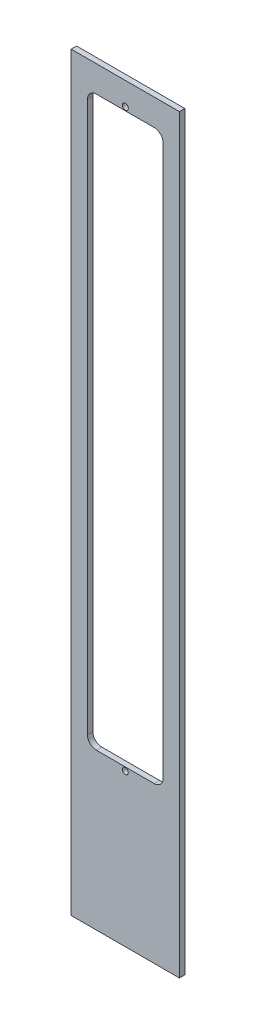
from build123d import *

# Parameters (mm, degrees)
ESQUISSE1_W              = 120
ESQUISSE1_H              = 832
BOSS_EXTRU_1_DEPTH       = 6
CUT_EXTRUDE1_DEPTH       = 10
M6_CLEARANCE_HOLE1_D     = 6.6
M6_CLEARANCE_HOLE1_DEPTH = 6
M6_CLEARANCE_HOLE1_TIP   = 1.982840043


with BuildPart() as part:
    # Esquisse1 → Boss.-Extru.1 (new body)
    with BuildSketch(Plane.XY):
        Rectangle(ESQUISSE1_W, ESQUISSE1_H)
    extrude(amount=BOSS_EXTRU_1_DEPTH)

    # Sketch1 → Cut-Extrude1 (cut)
    with BuildSketch(Plane.XY.offset(6)):
        with BuildLine():
            Line((-42, 376.726304266), (-42, -233.273695734))
            ThreePointArc((-42, -233.273695734), (-39.071067812, -240.344763545), (-32, -243.273695734))
            Line((-32, -243.273695734), (32, -243.273695734))
            ThreePointArc((32, -243.273695734), (39.071067812, -240.344763545), (42, -233.273695734))
            Line((42, -233.273695734), (42, 376.726304266))
            ThreePointArc((42, 376.726304266), (39.071067812, 383.797372078), (32, 386.726304266))
            Line((32, 386.726304266), (-32, 386.726304266))
            ThreePointArc((-32, 386.726304266), (-39.071067812, 383.797372078), (-42, 376.726304266))
        make_face()
    extrude(amount=-CUT_EXTRUDE1_DEPTH, mode=Mode.SUBTRACT)

    # M6 Clearance Hole1
    with Locations(Plane.XY.offset(6)):
        with Locations((0, 390.726304266), (0, -247.273695734)):
            Hole(M6_CLEARANCE_HOLE1_D / 2, depth=M6_CLEARANCE_HOLE1_DEPTH)
            with Locations((0, 0, -(M6_CLEARANCE_HOLE1_DEPTH + M6_CLEARANCE_HOLE1_TIP / 2))):  # 118° drill point
                Cone(0, M6_CLEARANCE_HOLE1_D / 2, M6_CLEARANCE_HOLE1_TIP, mode=Mode.SUBTRACT)


solid = part.part
